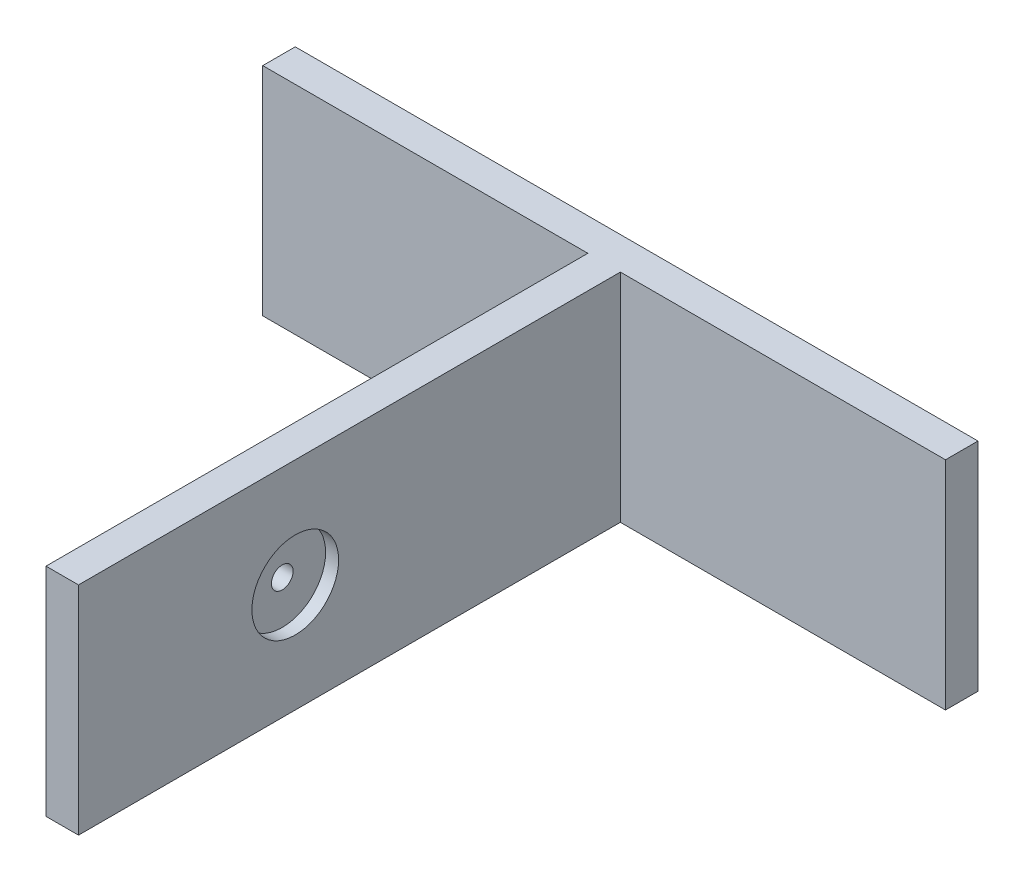
from build123d import *

# Parameters (mm, degrees)
SALIENTE_EXTRUIR1_DEPTH = 20
CROQUIS2_R              = 4
CORTAR_EXTRUIR1_DEPTH   = 1.2
CROQUIS3_R              = 1
CORTAR_EXTRUIR2_DEPTH   = 1.8
CROQUIS5_R              = 1
SALIENTE_EXTRUIR2_DEPTH = 1


with BuildPart() as part:
    # Croquis1 → Saliente-Extruir1 (new body)
    with BuildSketch(Plane(origin=(0, 0, 0), x_dir=(1, 0, 0), z_dir=(0, 1, 0))):
        Polygon((3.21663979, -38.197597505), (3.21663979, 11.802402495), (33.21663979, 11.802402495), (33.21663979, 14.802402495), (-29.78336021, 14.802402495), (-29.78336021, 11.802402495), (0.21663979, 11.802402495), (0.21663979, -38.197597505), align=None)
    extrude(amount=SALIENTE_EXTRUIR1_DEPTH)

    # Croquis2 → Cortar-Extruir1 (cut)
    with BuildSketch(Plane(origin=(3.21663979, 0, 0), x_dir=(0, 0, -1), z_dir=(1, 0, 0))):
        with Locations((-18.197597505, 10)):
            Circle(CROQUIS2_R)
    extrude(amount=-CORTAR_EXTRUIR1_DEPTH, mode=Mode.SUBTRACT)

    # Croquis3 → Cortar-Extruir2 (cut)
    with BuildSketch(Plane(origin=(2.01663979, 0, 0), x_dir=(0, 0, -1), z_dir=(1, 0, 0))):
        with Locations((-18.197597505, 10)):
            Circle(CROQUIS3_R)
    extrude(amount=-CORTAR_EXTRUIR2_DEPTH, mode=Mode.SUBTRACT)

    # Croquis5 → Saliente-Extruir2 (add)
    with BuildSketch(Plane(origin=(0, 0, -14.802402495), x_dir=(-1, 0, 0), z_dir=(0, 0, -1))):
        with Locations(Location((-1.71663979, 10, 0), (0, 0, 180))):
            Circle(CROQUIS5_R)
    extrude(amount=SALIENTE_EXTRUIR2_DEPTH)


solid = part.part
